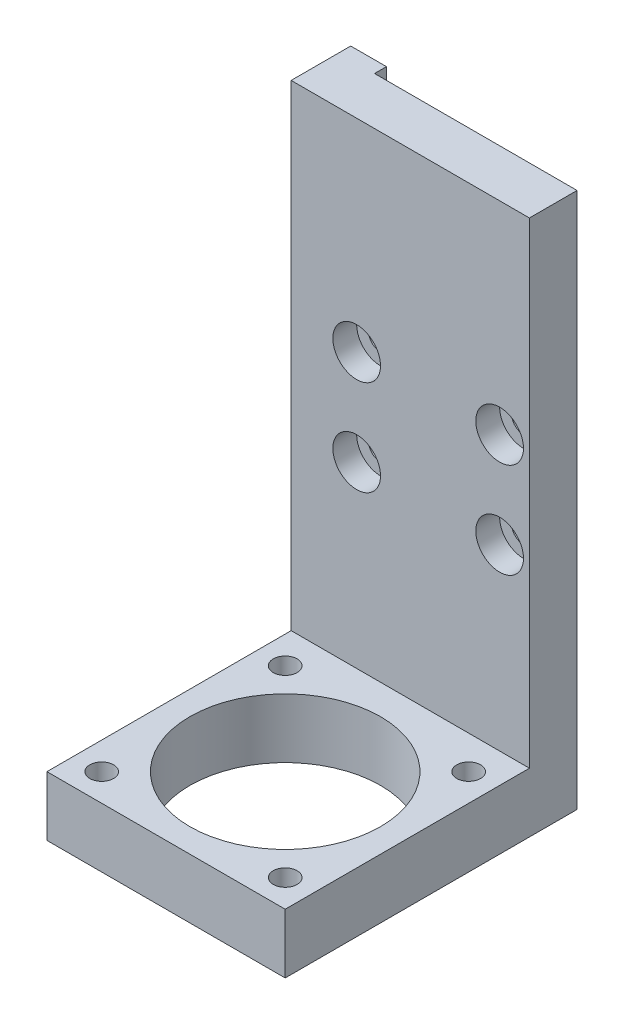
from build123d import *

# Parameters (mm, degrees)
BOSS_EXTRUDE1_DEPTH = 20
SKETCH3_R           = 8
SKETCH3_R_2         = 1
CUT_EXTRUDE1_DEPTH  = 10
SKETCH4_R           = 1
CUT_EXTRUDE2_DEPTH  = 10
SKETCH5_R           = 2
CUT_EXTRUDE3_DEPTH  = 2
SKETCH6_W           = 17
SKETCH6_H           = 1
CUT_EXTRUDE4_DEPTH  = 65


with BuildPart() as part:
    # Sketch1 → Boss-Extrude1 (new body)
    with BuildSketch(Plane(origin=(0, 0, 0), x_dir=(0, 0, -1), z_dir=(1, 0, 0))):
        Polygon((0, 0), (20.5, 0), (20.5, 40), (25.5, 40), (25.5, -5), (0, -5), align=None)
    extrude(amount=BOSS_EXTRUDE1_DEPTH)

    # Sketch3 → Cut-Extrude1 (cut)
    with BuildSketch(Plane(origin=(0, 0, 0), x_dir=(1, 0, 0), z_dir=(0, 1, 0))):
        with Locations(Location((10, 10, 0), (0, 0, 270))):
            Circle(SKETCH3_R)
        with Locations(Location((2.3, 17.7, 0), (0, 0, 270))):
            Circle(SKETCH3_R_2)
        with Locations(Location((17.7, 17.7, 0), (0, 0, 270))):
            Circle(SKETCH3_R_2)
        with Locations(Location((17.7, 2.3, 0), (0, 0, 270))):
            Circle(SKETCH3_R_2)
        with Locations(Location((2.3, 2.3, 0), (0, 0, 270))):
            Circle(SKETCH3_R_2)
    extrude(amount=-CUT_EXTRUDE1_DEPTH, mode=Mode.SUBTRACT)

    # Sketch4 → Cut-Extrude2 (cut)
    with BuildSketch(Plane.XY.offset(-20.5)):
        with Locations((5.5, 15)):
            Circle(SKETCH4_R)
        with Locations((5.5, 23)):
            Circle(SKETCH4_R)
        with Locations((17.5, 23)):
            Circle(SKETCH4_R)
        with Locations((17.5, 15)):
            Circle(SKETCH4_R)
    extrude(amount=-CUT_EXTRUDE2_DEPTH, mode=Mode.SUBTRACT)

    # Sketch5 → Cut-Extrude3 (cut)
    with BuildSketch(Plane.XY.offset(-20.5)):
        with Locations((5.5, 23)):
            Circle(SKETCH5_R)
        with Locations((5.5, 15)):
            Circle(SKETCH5_R)
        with Locations((17.5, 15)):
            Circle(SKETCH5_R)
        with Locations((17.5, 23)):
            Circle(SKETCH5_R)
    extrude(amount=-CUT_EXTRUDE3_DEPTH, mode=Mode.SUBTRACT)

    # Sketch6 → Cut-Extrude4 (cut)
    with BuildSketch(Plane(origin=(0, 40, 0), x_dir=(1, 0, 0), z_dir=(0, 1, 0))):
        with Locations((11.5, 25)):
            Rectangle(SKETCH6_W, SKETCH6_H)
    extrude(amount=-CUT_EXTRUDE4_DEPTH, mode=Mode.SUBTRACT)


solid = part.part
